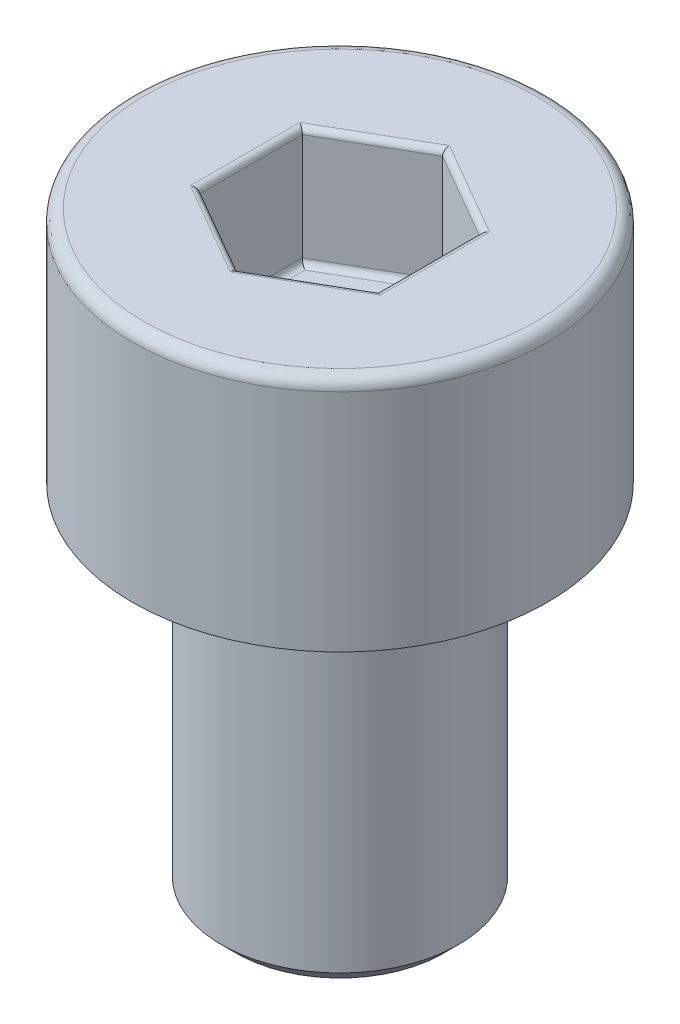
from build123d import *

# Parameters (mm, degrees)
CHAMFER1_SIZE      = 0.25
FILLET1_R          = 0.2
CUT_EXTRUDE1_DEPTH = 2
FILLET2_R          = 0.1


with BuildPart() as part:
    # Sketch1 → Revolve1 (revolve)
    with BuildSketch(Plane.XY, mode=Mode.PRIVATE) as revolve1_sk:
        Polygon((0, -10), (-2, -10), (-2, -4), (-3.5, -4), (-3.5, 0), (0, 0), align=None)
    revolve(revolve1_sk.sketch.rotate(Axis((0, 0, 0), (0, -1, 0)), 270), axis=Axis((0, 0, 0), (0, -1, 0)))

    # Chamfer1
    chamfer1_edges = [part.edges().sort_by_distance(p)[0] for p in [
        (0, -4, -2),
        (0, -10, -2),
    ]]
    chamfer(chamfer1_edges, length=CHAMFER1_SIZE)

    # Fillet1
    fillet1_edges = [part.edges().sort_by_distance(p)[0] for p in [
        (0, 0, -3.5),
    ]]
    fillet(fillet1_edges, radius=FILLET1_R)

    # Sketch2 → Cut-Extrude1 (cut)
    with BuildSketch(Plane(origin=(0, 0, 0), x_dir=(1, 0, 0), z_dir=(0, 1, 0))):
        Polygon((0, 1.732050808), (-1.5, 0.866025404), (-1.5, -0.866025404), (0, -1.732050808), (1.5, -0.866025404), (1.5, 0.866025404), align=None)
    extrude(amount=-CUT_EXTRUDE1_DEPTH, mode=Mode.SUBTRACT)

    # Fillet2
    fillet2_edges = [part.edges().sort_by_distance(p)[0] for p in [
        (0.75, -2, -1.299038106),
        (1.5, -2, 0),
        (0.75, -2, 1.299038106),
        (-0.75, -2, 1.299038106),
        (-1.5, -2, 0),
        (-0.75, -2, -1.299038106),
        (0.75, 0, -1.299038106),
        (-0.75, 0, -1.299038106),
        (-1.5, 0, 0),
        (-0.75, 0, 1.299038106),
        (0.75, 0, 1.299038106),
        (1.5, 0, 0),
    ]]
    fillet(fillet2_edges, radius=FILLET2_R)


solid = part.part
